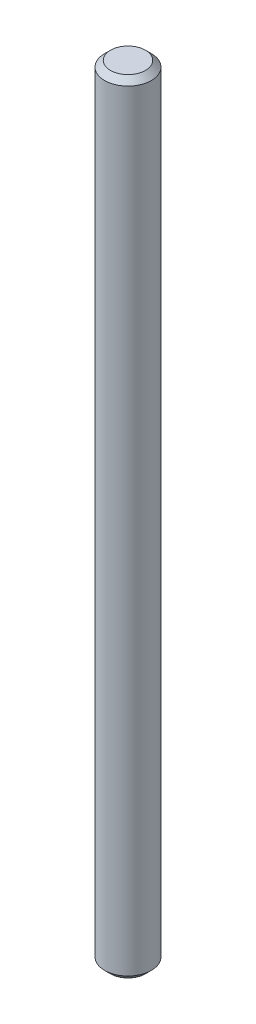
from build123d import *

# Parameters (mm, degrees)
SKETCH1_R           = 4
BOSS_EXTRUDE1_DEPTH = 134
CHAMFER1_SIZE       = 1


with BuildPart() as part:
    # Sketch1 → Boss-Extrude1 (new body)
    with BuildSketch(Plane(origin=(0, 0, 0), x_dir=(1, 0, 0), z_dir=(0, 1, 0))):
        with Locations(Location((0, 0, 0), (0, 0, 270))):
            Circle(SKETCH1_R)
    extrude(amount=BOSS_EXTRUDE1_DEPTH)

    # Chamfer1
    chamfer1_edges = [part.edges().sort_by_distance(p)[0] for p in [
        (0, 0, -4),
        (0, 134, -4),
    ]]
    chamfer(chamfer1_edges, length=CHAMFER1_SIZE)


solid = part.part
